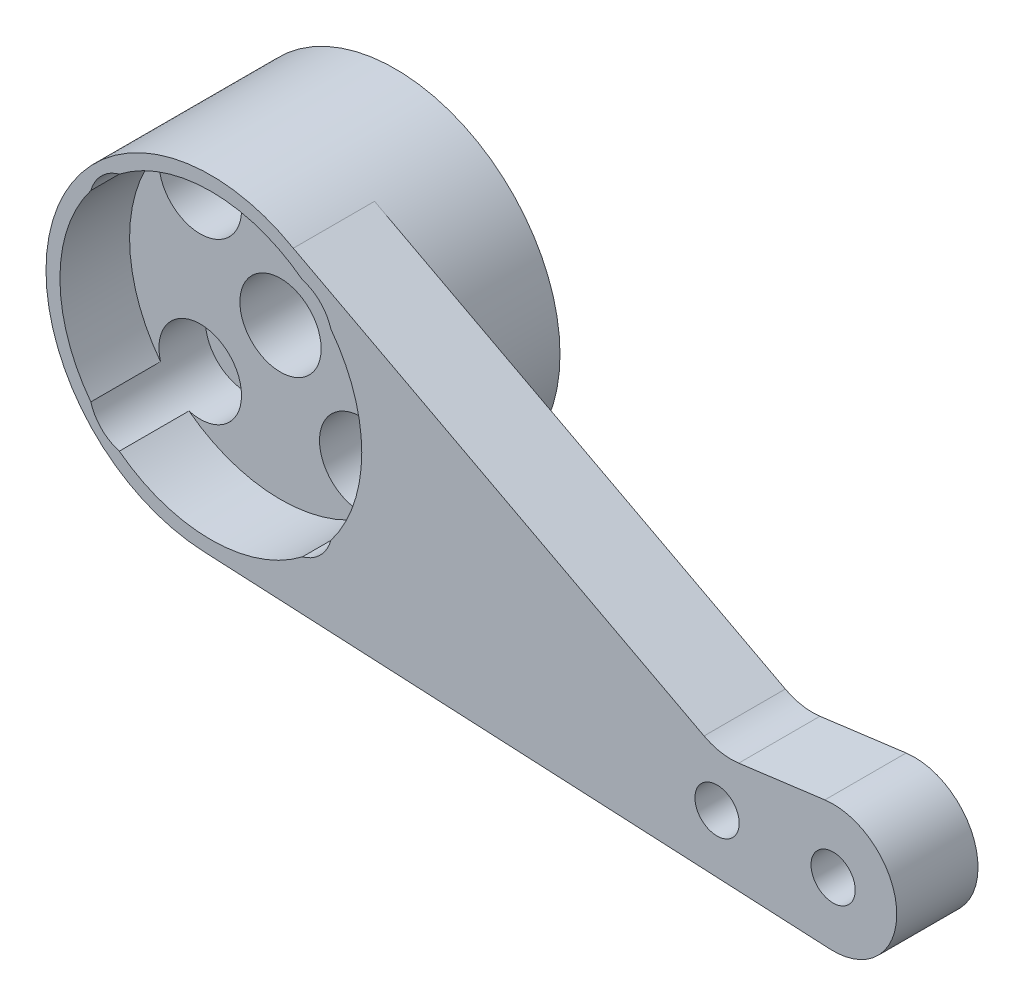
from build123d import *
from build123d.topology import SkipClean

# Parameters (mm, degrees)
BOSS_EXTRUDE1_DEPTH                     = 15
CBORE_FOR_M6_HEX_HEAD_BOLT1_D           = 7
CBORE_FOR_M6_HEX_HEAD_BOLT1_CBORE_D     = 25.6
CBORE_FOR_M6_HEX_HEAD_BOLT1_CBORE_DEPTH = 3
SKETCH30_W                              = 87.8922038
SKETCH30_H                              = 63.386693804
CUT_EXTRUDE8_DEPTH                      = 0.125
SKETCH31_W                              = 82.344977649
SKETCH31_H                              = 39.024548637
CUT_EXTRUDE9_DEPTH                      = 0.125
SKETCH38_R                              = 1.905
CUT_EXTRUDE10_DEPTH                     = 68.319909946
SKETCH39_OUTSIDE_W                      = 91.473
SKETCH39_OUTSIDE_H                      = 49.266
SKETCH39_OUTSIDE_R                      = 12.8
CUT_EXTRUDE11_DEPTH                     = 7.75
SKETCH40_R                              = 13
CUT_EXTRUDE12_DEPTH                     = 6
BOSS_EXTRUDE2_START                     = 4
SKETCH41_R                              = 12.8
BOSS_EXTRUDE2_DEPTH                     = 4
SKETCH42_R                              = 3.5
SKETCH42_R_2                            = 1.905
CUT_EXTRUDE13_DEPTH                     = 67.748958045
SKETCH43_R                              = 14.2
SKETCH43_R_2                            = 12.8
BOSS_EXTRUDE3_DEPTH                     = 8.875
CUT_EXTRUDE14_DEPTH                     = 67.422311011
CUT_EXTRUDE14_DEPTH_BACK                = 4
SKETCH44_R                              = 3.556
SKETCH45_R                              = 1.905
CUT_EXTRUDE15_DEPTH                     = 67.2810184
SKETCH46_R                              = 3.556
CUT_EXTRUDE16_DEPTH                     = 2
SKETCH47_W                              = 10
SKETCH47_H                              = 3.81
CUT_EXTRUDE17_DEPTH                     = 2


with BuildPart() as part:
    # Sketch1 → Boss-Extrude1 (new body)
    with BuildSketch(Plane(origin=(0, 0, 0), x_dir=(-1, 0, 0), z_dir=(0, 0, -1))):
        with BuildLine():
            Line((-54.628463331, -5.212133486), (-0.593380164, -2.525889334))
            ThreePointArc((-0.593380164, -2.525889334), (12.32206912, 15.671805741), (-8.399323253, 23.953643362))
            Line((-8.399323253, 23.953643362), (-43.781031906, 5.260553383))
            ThreePointArc((-43.781031906, 5.260553383), (-45.231601083, 4.760443022), (-46.765522471, 4.723748524))
            Line((-46.765522471, 4.723748524), (-54.189447973, 5.695292216))
            ThreePointArc((-54.189447973, 5.695292216), (-60.376392814, 0.481764046), (-54.628463331, -5.212133486))
        make_face()
    extrude(amount=-BOSS_EXTRUDE1_DEPTH)

    # CBORE for M6 Hex Head Bolt1 (through all)
    with Locations(Plane(origin=(0, 0, 0), x_dir=(-1, 0, 0), z_dir=(0, 0, -1))):
        with Locations((-1.298433566, 11.656596333)):
            CounterBoreHole(CBORE_FOR_M6_HEX_HEAD_BOLT1_D / 2, CBORE_FOR_M6_HEX_HEAD_BOLT1_CBORE_D / 2, CBORE_FOR_M6_HEX_HEAD_BOLT1_CBORE_DEPTH)

    # Sketch30 → Cut-Extrude8 (cut)
    with BuildSketch(Plane.XY.offset(15)):
        with Locations((24.760370948, 9.451685766)):
            Rectangle(SKETCH30_W, SKETCH30_H)
    extrude(amount=-CUT_EXTRUDE8_DEPTH, mode=Mode.SUBTRACT)

    # Sketch31 → Cut-Extrude9 (cut)
    with BuildSketch(Plane(origin=(0, 0, 0), x_dir=(-1, 0, 0), z_dir=(0, 0, -1))):
        with Locations((-23.438477607, 10.614160855)):
            Rectangle(SKETCH31_W, SKETCH31_H)
    extrude(amount=-CUT_EXTRUDE9_DEPTH, mode=Mode.SUBTRACT)

    # Sketch38 → Cut-Extrude10 (cut, through all)
    with BuildSketch(Plane.XY.offset(14.875)):
        with Locations((-5.615950455, 18.571806714)):
            Circle(SKETCH38_R)
        with Locations((8.213643947, 18.570980353)):
            Circle(SKETCH38_R)
        with Locations((8.212817586, 4.741385951)):
            Circle(SKETCH38_R)
        with Locations((-5.616776816, 4.742212313)):
            Circle(SKETCH38_R)
    extrude(amount=-CUT_EXTRUDE10_DEPTH, mode=Mode.SUBTRACT)

    # Sketch39 outside → Cut-Extrude11 (cut)
    with BuildSketch(Plane(origin=(0, 0, 0.125), x_dir=(-1, 0, 0), z_dir=(0, 0, -1))):
        with Locations((-23.7395, 10.319)):
            Rectangle(SKETCH39_OUTSIDE_W, SKETCH39_OUTSIDE_H)
        with Locations(Location((-1.298433566, 11.656596333, 0), (0, 0, 180))):
            Circle(SKETCH39_OUTSIDE_R, mode=Mode.SUBTRACT)
    extrude(amount=-CUT_EXTRUDE11_DEPTH, mode=Mode.SUBTRACT)

    # Sketch40 → Cut-Extrude12 (cut)
    with BuildSketch(Plane.XY.offset(14.875)):
        with Locations((1.298433566, 11.656596333)):
            Circle(SKETCH40_R)
    extrude(amount=-CUT_EXTRUDE12_DEPTH, mode=Mode.SUBTRACT)

    # Sketch41 → Boss-Extrude2 (add)
    with BuildSketch(Plane(origin=(0, 0, 3), x_dir=(-1, 0, 0), z_dir=(0, 0, -1)).offset(BOSS_EXTRUDE2_START)):
        with Locations((-1.298433566, 11.656596333)):
            Circle(SKETCH41_R)
    extrude(amount=-BOSS_EXTRUDE2_DEPTH)

    # Sketch42 → Cut-Extrude13 (cut, through all)
    with BuildSketch(Plane.XY.offset(3)):
        with Locations((1.298433566, 11.656596333)):
            Circle(SKETCH42_R)
        with Locations((8.212817586, 4.741385951)):
            Circle(SKETCH42_R_2)
        with Locations((-5.616776816, 4.742212313)):
            Circle(SKETCH42_R_2)
        with Locations((-5.615950455, 18.571806714)):
            Circle(SKETCH42_R_2)
        with Locations((8.213643947, 18.570980353)):
            Circle(SKETCH42_R_2)
    extrude(amount=-CUT_EXTRUDE13_DEPTH, mode=Mode.SUBTRACT)

    # Sketch43 → Boss-Extrude3 (add, through all)
    with SkipClean():  # the faces are left unmerged after this step: merging them gives an invalid solid
        with BuildSketch(Plane(origin=(0, 0, 7.875), x_dir=(-1, 0, 0), z_dir=(0, 0, -1))):
            with Locations((-1.298433566, 11.656596333)):
                Circle(SKETCH43_R)
            with Locations((-1.298433566, 11.656596333)):
                Circle(SKETCH43_R_2, mode=Mode.SUBTRACT)
        extrude(amount=BOSS_EXTRUDE3_DEPTH)

    # Sketch44 → Cut-Extrude14 (cut, two sides: drawn at the far end of the back side and taken through both)
    with SkipClean():  # the faces are left unmerged after this step: merging them gives an invalid solid
        with BuildSketch(Plane.XY.offset(8.875).offset(-CUT_EXTRUDE14_DEPTH_BACK)):
            with Locations((8.213643947, 18.570980353)):
                Circle(SKETCH44_R)
            with Locations((-5.615950455, 18.571806714)):
                Circle(SKETCH44_R)
            with Locations((-5.616776816, 4.742212313)):
                Circle(SKETCH44_R)
            with Locations((8.212817586, 4.741385951)):
                Circle(SKETCH44_R)
        extrude(amount=CUT_EXTRUDE14_DEPTH + CUT_EXTRUDE14_DEPTH_BACK, mode=Mode.SUBTRACT)

    # Sketch45 → Cut-Extrude15 (cut, through all)
    with SkipClean():  # the faces are left unmerged after this step: merging them gives an invalid solid
        with BuildSketch(Plane(origin=(0, 0, 7.875), x_dir=(-1, 0, 0), z_dir=(0, 0, -1))):
            with Locations((-54.900567232, 0.261366347)):
                Circle(SKETCH45_R)
            with Locations((-44.900567232, 0.261366347)):
                Circle(SKETCH45_R)
        extrude(amount=-CUT_EXTRUDE15_DEPTH, mode=Mode.SUBTRACT)

    # Sketch46 → Cut-Extrude16 (cut)
    with SkipClean():  # the faces are left unmerged after this step: merging them gives an invalid solid
        with BuildSketch(Plane(origin=(0, 0, 7.875), x_dir=(-1, 0, 0), z_dir=(0, 0, -1))):
            with Locations((-54.900567232, 0.261366347)):
                Circle(SKETCH46_R)
            with Locations((-44.900567232, 0.261366347)):
                Circle(SKETCH46_R)
        extrude(amount=-CUT_EXTRUDE16_DEPTH, mode=Mode.SUBTRACT)

    # Sketch47 → Cut-Extrude17 (cut)
    with SkipClean():  # the faces are left unmerged after this step: merging them gives an invalid solid
        with BuildSketch(Plane(origin=(0, 0, 7.875), x_dir=(-1, 0, 0), z_dir=(0, 0, -1))):
            with Locations((-49.900567232, 0.261366347)):
                Rectangle(SKETCH47_W, SKETCH47_H)
        extrude(amount=-CUT_EXTRUDE17_DEPTH, mode=Mode.SUBTRACT)


solid = part.part
